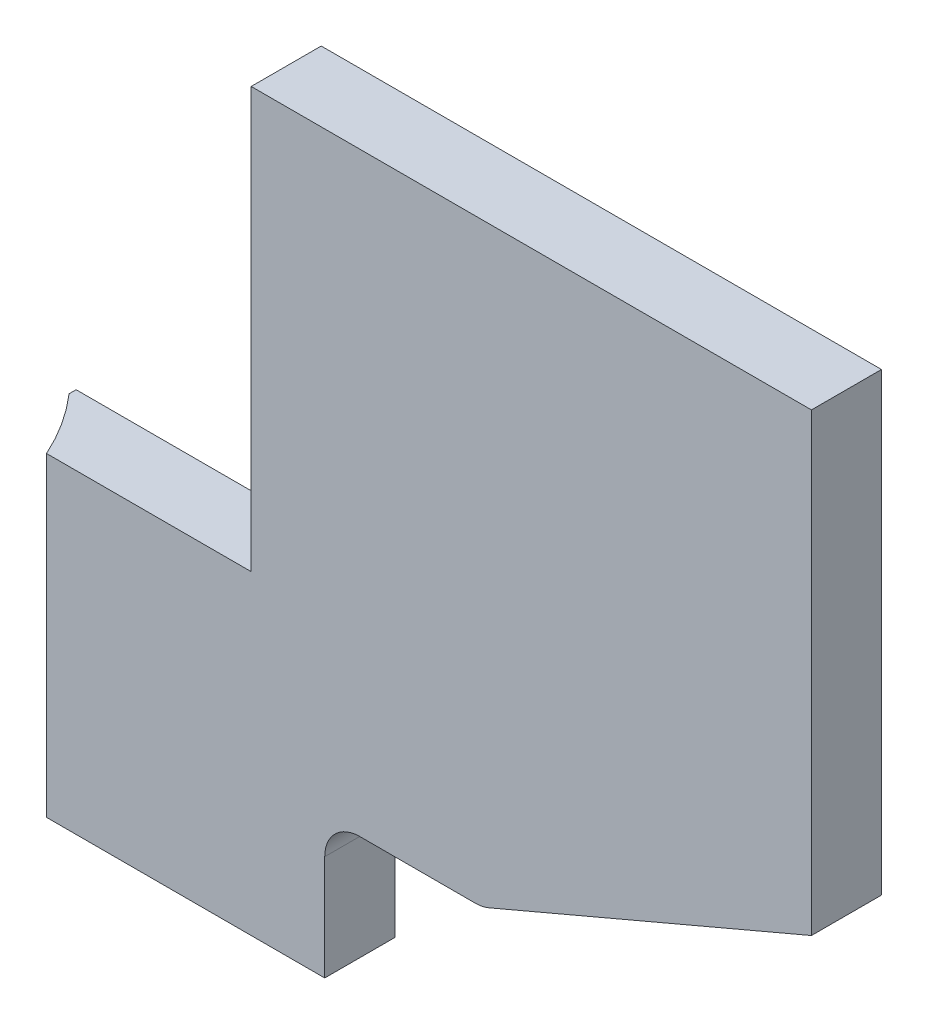
from build123d import *

# Parameters (mm, degrees)
SKETCH1_W           = 80
SKETCH1_H           = 65
BOSS_EXTRUDE1_DEPTH = 10
SKETCH3_W           = 80
SKETCH3_H           = 10
BOSS_EXTRUDE2_DEPTH = 40
SKETCH4_W           = 10
SKETCH4_H           = 45
BOSS_EXTRUDE3_DEPTH = 35
SKETCH5_R           = 36.5
CUT_EXTRUDE2_DEPTH  = 97.566039579
CUT_EXTRUDE3_DEPTH  = 105.791459576


with BuildPart() as part:
    # Sketch1 → Boss-Extrude1 (new body)
    with BuildSketch(Plane.XY):
        Rectangle(SKETCH1_W, SKETCH1_H)
    extrude(amount=BOSS_EXTRUDE1_DEPTH)

    # Sketch3 → Boss-Extrude2 (add)
    with BuildSketch(Plane.XZ.offset(32.5)):
        with Locations((0, 5)):
            Rectangle(SKETCH3_W, SKETCH3_H)
    extrude(amount=BOSS_EXTRUDE2_DEPTH)

    # Sketch4 → Boss-Extrude3 (add)
    with BuildSketch(Plane.ZY.offset(40)):
        with Locations((5, -50)):
            Rectangle(SKETCH4_W, SKETCH4_H)
    extrude(amount=BOSS_EXTRUDE3_DEPTH)

    # Sketch5 → Cut-Extrude2 (cut, through all)
    with BuildSketch(Plane(origin=(0, -27.5, 0), x_dir=(1, 0, 0), z_dir=(0, 1, 0))):
        with Locations((-102.5, -25)):
            Circle(SKETCH5_R)
    extrude(amount=-CUT_EXTRUDE2_DEPTH, mode=Mode.SUBTRACT)

    # Sketch6 → Cut-Extrude3 (cut, through all)
    with BuildSketch(Plane.XY.offset(10)):
        with BuildLine():
            Line((-29.5, -72.5), (40, -72.5))
            Line((40, -72.5), (40, -32.5))
            Line((40, -32.5), (-6.061816969, -52.100773178))
            ThreePointArc((-6.061816969, -52.100773178), (-7.020559729, -52.399176762), (-8.019592789, -52.5))
            Line((-8.019592789, -52.5), (-24.5, -52.5))
            ThreePointArc((-24.5, -52.5), (-28.035533906, -53.964466094), (-29.5, -57.5))
            Line((-29.5, -57.5), (-29.5, -72.5))
        make_face()
    extrude(amount=-CUT_EXTRUDE3_DEPTH, mode=Mode.SUBTRACT)


solid = part.part
